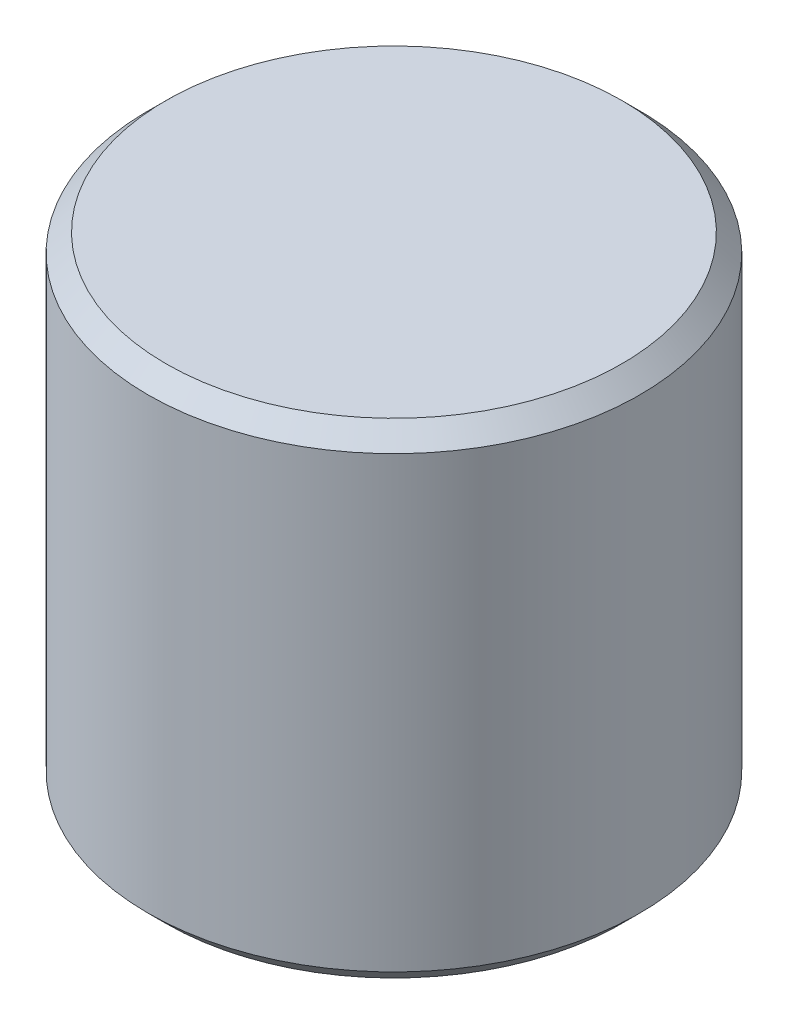
from build123d import *


with BuildPart() as part:
    # ｽｹｯﾁ1 → 回転1 (revolve)
    with BuildSketch(Plane.XY, mode=Mode.PRIVATE) as revolve_1_sk:
        Polygon((5.5, 0), (6.35, 0), (6.85, 0.5), (6.85, 13), (6.35, 13.5), (0, 13.5), (0, 11.6), (3.05, 11.6), (3.05, 2), (5.5, 2), align=None)
    revolve(revolve_1_sk.sketch.rotate(Axis((0, 13.5, 0), (0, -1, 0)), 90), axis=Axis((0, 13.5, 0), (0, -1, 0)))


solid = part.part
